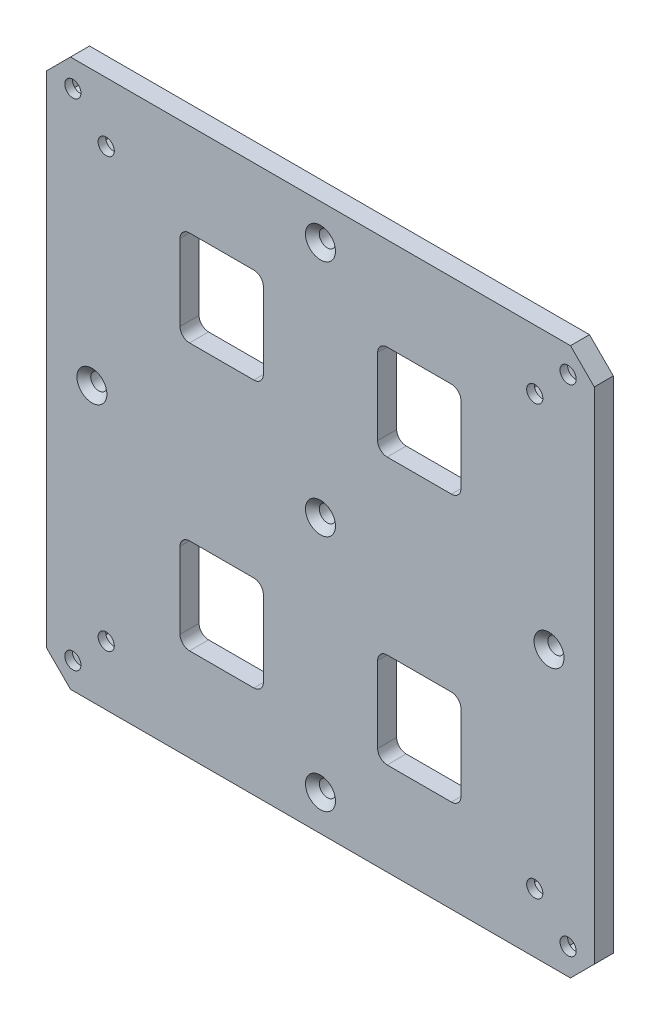
from build123d import *

# Parameters (mm, degrees)
SKETCH2_W                                       = 57.5
SKETCH2_H                                       = 57.5
BOSS_EXTRUDE1_DEPTH                             = 4
CUT_EXTRUDE4_DEPTH                              = 2.4
M3_CLEARANCE_HOLE1_D                            = 3.4
CSK_FOR_M3_FLAT_HEAD_MACHINE_SCREW1_D           = 3.4
CSK_FOR_M3_FLAT_HEAD_MACHINE_SCREW1_CSINK_D     = 6.3
CSK_FOR_M3_FLAT_HEAD_MACHINE_SCREW1_CSINK_ANGLE = 90
SKETCH11_W                                      = 17.5
SKETCH11_H                                      = 20
CUT_EXTRUDE3_DEPTH                              = 82.415600471
FILLET1_R                                       = 2
CUT_EXTRUDE6_DEPTH                              = 2.4
M3_CLEARANCE_HOLE2_D                            = 3.4
CHAMFER1_SIZE                                   = 5


with BuildPart() as part:
    # Sketch2 → Boss-Extrude1 (new body)
    with BuildSketch(Plane.XY):
        with Locations((28.75, 28.75)):
            Rectangle(SKETCH2_W, SKETCH2_H)
    extrude(amount=BOSS_EXTRUDE1_DEPTH)

    # Sketch12 → Cut-Extrude4 (cut)
    with BuildSketch(Plane.XY):
        Polygon((45, 41.766838493), (47.8, 43.383419246), (47.8, 46.616580754), (45, 48.233161507), (42.2, 46.616580754), (42.2, 43.383419246), align=None)
    extrude(amount=CUT_EXTRUDE4_DEPTH, mode=Mode.SUBTRACT)

    # M3 Clearance Hole1 (through all)
    with Locations(Plane.XY.offset(4)):
        with Locations((45, 45), (-45, 45), (-45, -45), (45, -45)):
            Hole(M3_CLEARANCE_HOLE1_D / 2)

    # CSK for M3 Flat Head Machine Screw1 (through all)
    with Locations(Plane.XY.offset(4)):
        with Locations((0, 50), (0, 0), (48, 0)):
            CounterSinkHole(CSK_FOR_M3_FLAT_HEAD_MACHINE_SCREW1_D / 2, CSK_FOR_M3_FLAT_HEAD_MACHINE_SCREW1_CSINK_D / 2, counter_sink_angle=CSK_FOR_M3_FLAT_HEAD_MACHINE_SCREW1_CSINK_ANGLE)

    # Sketch11 → Cut-Extrude3 (cut, through all)
    with BuildSketch(Plane.XY):
        with Locations((20.75, 28)):
            Rectangle(SKETCH11_W, SKETCH11_H)
    extrude(amount=CUT_EXTRUDE3_DEPTH, mode=Mode.SUBTRACT)

    # Fillet1
    fillet1_edges = [part.edges().sort_by_distance(p)[0] for p in [
        (29.5, 38, 2),
        (12, 38, 2),
        (12, 18, 2),
        (29.5, 18, 2),
    ]]
    fillet(fillet1_edges, radius=FILLET1_R)

    # Sketch15 → Cut-Extrude6 (cut)
    with BuildSketch(Plane.XY):
        Polygon((54.286190427, 49.713809573), (55.122994201, 52.836803774), (52.836803774, 55.122994201), (49.713809573, 54.286190427), (48.877005799, 51.163196226), (51.163196226, 48.877005799), align=None)
    extrude(amount=CUT_EXTRUDE6_DEPTH, mode=Mode.SUBTRACT)

    # M3 Clearance Hole2 (through all)
    with Locations(Plane(origin=(0, 0, 0), x_dir=(-1, 0, 0), z_dir=(0, 0, -1))):
        with Locations((-52, 52)):
            Hole(M3_CLEARANCE_HOLE2_D / 2)

    # Chamfer1
    chamfer1_edges = [part.edges().sort_by_distance(p)[0] for p in [
        (57.5, 57.5, 2),
    ]]
    chamfer(chamfer1_edges, length=CHAMFER1_SIZE)

    # Mirror1: part across plane


with BuildPart() as part_1:
    add(part.part)
    add(part.part.mirror(Plane(origin=(0, 0, 0), x_dir=(0, 0, 1), z_dir=(0, -1, 0))))

    # Mirror2: part across plane


with BuildPart() as part_2:
    add(part_1.part)
    add(part_1.part.mirror(Plane(origin=(0, 0, 0), x_dir=(0, 0, 1), z_dir=(1, 0, 0))))


solid = part_2.part
